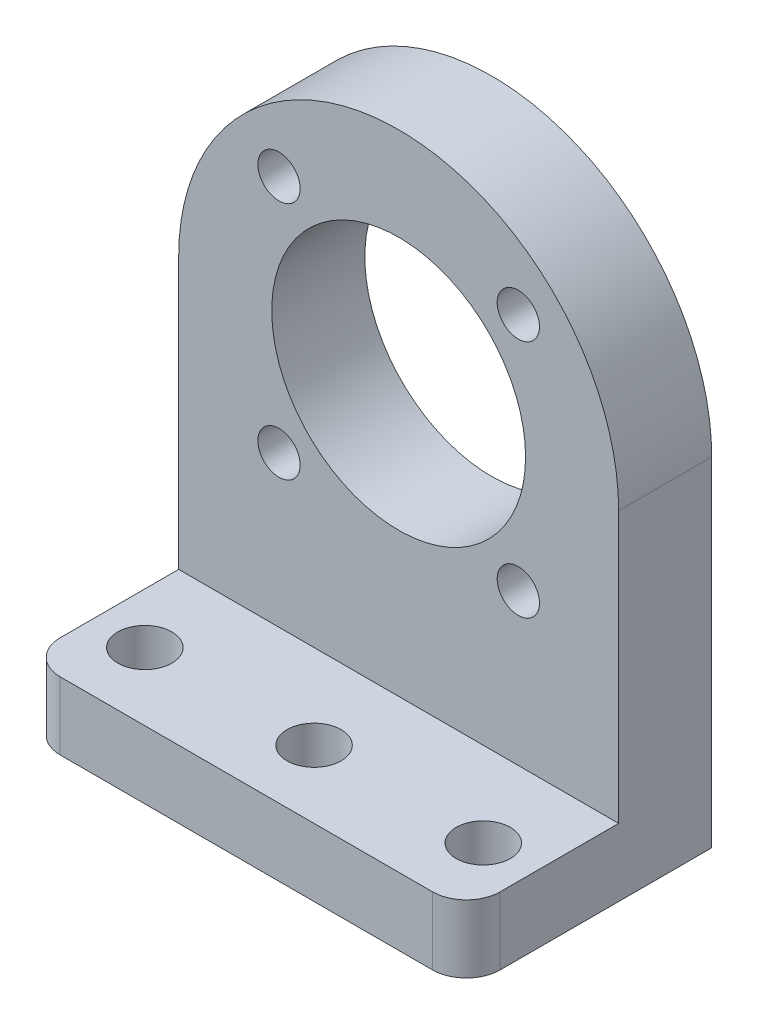
from build123d import *

# Parameters (mm, degrees)
SKETCH_1_R          = 7.5
SKETCH_1_R_2        = 1.25
EXTRUDE_1_DEPTH     = 5.5
SKETCH_2_W          = 26
SKETCH_2_H          = 4
EXTRUDE_2_DEPTH     = 9
SKETCH_3_R          = 1.6
CUT_EXTRUDE_1_DEPTH = 12
FILLET_1_R          = 2


with BuildPart() as part:
    # 草图1 → 凸台-拉伸1 (new body)
    with BuildSketch(Plane.XY):
        with BuildLine():
            Line((-13, 0), (-13, -20))
            Line((-13, -20), (13, -20))
            Line((13, -20), (13, 0))
            ThreePointArc((13, 0), (0, 13), (-13, 0))
        make_face()
        Circle(SKETCH_1_R, mode=Mode.SUBTRACT)
        with Locations((-7.071067812, 7.071067812)):
            Circle(SKETCH_1_R_2, mode=Mode.SUBTRACT)
        with Locations((7.071067812, 7.071067812)):
            Circle(SKETCH_1_R_2, mode=Mode.SUBTRACT)
        with Locations((7.071067812, -7.071067812)):
            Circle(SKETCH_1_R_2, mode=Mode.SUBTRACT)
        with Locations((-7.071067812, -7.071067812)):
            Circle(SKETCH_1_R_2, mode=Mode.SUBTRACT)
    extrude(amount=EXTRUDE_1_DEPTH)

    # 草图2 → 凸台-拉伸2 (add)
    with BuildSketch(Plane.XY.offset(5.5)):
        with Locations((0, -18)):
            Rectangle(SKETCH_2_W, SKETCH_2_H)
    extrude(amount=EXTRUDE_2_DEPTH)

    # 草图3 → 切除-拉伸1 (cut)
    with BuildSketch(Plane(origin=(0, -16, 0), x_dir=(1, 0, 0), z_dir=(0, 1, 0))):
        with Locations(Location((-10, -10.5, 0), (0, 0, 270))):
            Circle(SKETCH_3_R)
        with Locations(Location((0, -10.5, 0), (0, 0, 270))):
            Circle(SKETCH_3_R)
        with Locations(Location((10, -10.5, 0), (0, 0, 270))):
            Circle(SKETCH_3_R)
    extrude(amount=-CUT_EXTRUDE_1_DEPTH, mode=Mode.SUBTRACT)

    # 圆角1
    fillet_1_edges = [part.edges().sort_by_distance(p)[0] for p in [
        (-13, -18, 14.5),
        (13, -18, 14.5),
    ]]
    fillet(fillet_1_edges, radius=FILLET_1_R)


solid = part.part
